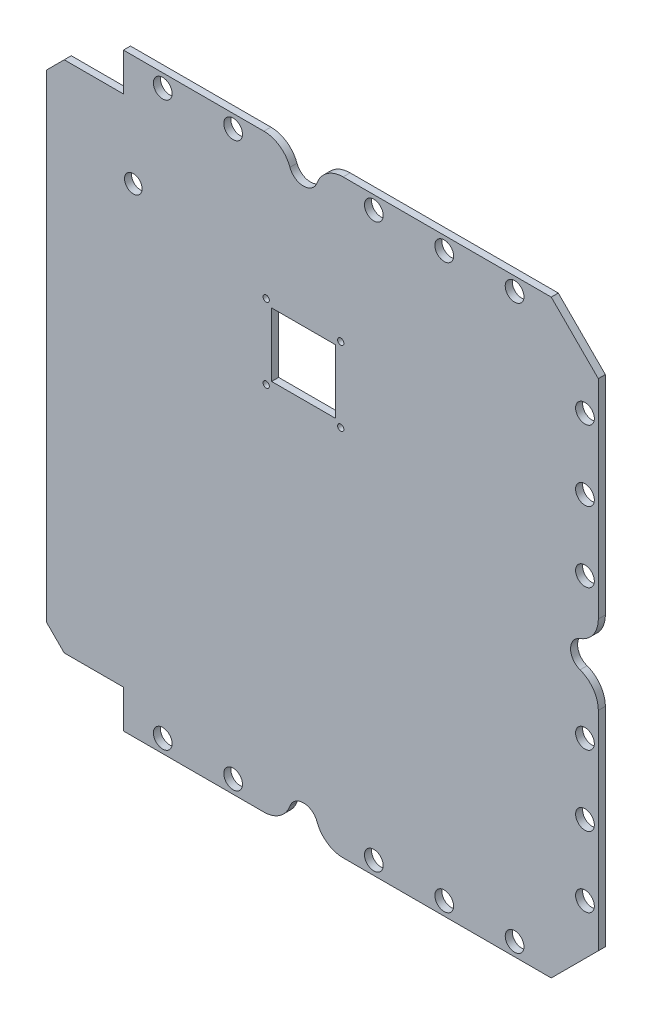
from build123d import *

# Parameters (mm, degrees)
SKETCH1_R             = 3.38
SKETCH1_W             = 23
SKETCH1_H             = 23
SKETCH1_R_2           = 1.13
SKETCH1_R_3           = 3.175
BOSS_EXTRUDE1_DEPTH   = 2.54
F_4_40_TAPPED_HOLE1_D = 2.2606
FILLET1_R             = 10


with BuildPart() as part:
    # Sketch1 → Boss-Extrude1 (new body)
    with BuildSketch(Plane.XY):
        with BuildLine():
            Line((101.231699996, -8e-08), (41.425999995, -8e-08))
            Line((41.425999995, -8e-08), (41.425999995, -13.716000085))
            Line((41.425999995, -13.716000085), (20.065999995, -13.716000085))
            Line((20.065999995, -13.716000085), (13.715999995, -20.066000085))
            Line((13.715999995, -20.066000085), (13.715999995, -192.786000085))
            Line((13.715999995, -192.786000085), (20.065999995, -199.136000085))
            Line((20.065999995, -199.136000085), (41.425999995, -199.136000085))
            Line((41.425999995, -199.136000085), (41.425999995, -212.852000091))
            Line((41.425999995, -212.852000091), (101.231699997, -212.852000091))
            Line((101.231699997, -212.852000091), (101.231699997, -208.02600019))
            ThreePointArc((101.231699996, -208.02600019), (106.425999995, -202.83170019), (111.620299995, -208.02600019))
            Line((111.620299996, -208.02600019), (111.620299996, -212.852000091))
            Line((111.620299996, -212.852000091), (195.854149957, -212.852000091))
            Line((195.854149957, -212.852000091), (212.851999956, -195.854150092))
            Line((212.851999956, -195.854150092), (212.851999956, -111.620300137))
            Line((212.851999956, -111.620300137), (208.026000047, -111.620300137))
            ThreePointArc((208.026000047, -111.620300137), (202.831700048, -106.426000137), (208.026000047, -101.231700138))
            Line((208.026000047, -101.231700138), (212.851999956, -101.231700138))
            Line((212.851999956, -101.231700138), (212.851999956, -16.997850079))
            Line((212.851999956, -16.997850079), (195.854149957, -8e-08))
            Line((195.854149957, -8e-08), (111.620299995, -8e-08))
            Line((111.620299995, -8e-08), (111.620299995, -4.826000085))
            ThreePointArc((111.620299994, -4.826000085), (106.425999995, -10.020300084), (101.231699996, -4.826000085))
            Line((101.231699996, -4.826000085), (101.231699996, -8e-08))
        make_face()
        with Locations((55.625999995, -208.02600019)):
            Circle(SKETCH1_R, mode=Mode.SUBTRACT)
        with Locations((81.025999995, -208.02600019)):
            Circle(SKETCH1_R, mode=Mode.SUBTRACT)
        with Locations((131.825999995, -208.02600019)):
            Circle(SKETCH1_R, mode=Mode.SUBTRACT)
        with Locations((157.225999995, -208.02600019)):
            Circle(SKETCH1_R, mode=Mode.SUBTRACT)
        with Locations((182.625999995, -208.02600019)):
            Circle(SKETCH1_R, mode=Mode.SUBTRACT)
        with Locations((208.026000047, -182.626000137)):
            Circle(SKETCH1_R, mode=Mode.SUBTRACT)
        with Locations((208.026000047, -157.226000137)):
            Circle(SKETCH1_R, mode=Mode.SUBTRACT)
        with Locations((208.026000047, -131.826000137)):
            Circle(SKETCH1_R, mode=Mode.SUBTRACT)
        with Locations((55.625999995, -4.826000085)):
            Circle(SKETCH1_R, mode=Mode.SUBTRACT)
        with Locations((81.025999995, -4.826000085)):
            Circle(SKETCH1_R, mode=Mode.SUBTRACT)
        with Locations((208.026000047, -81.026000137)):
            Circle(SKETCH1_R, mode=Mode.SUBTRACT)
        with Locations((208.026000047, -55.626000137)):
            Circle(SKETCH1_R, mode=Mode.SUBTRACT)
        with Locations((131.825999995, -4.826000085)):
            Circle(SKETCH1_R, mode=Mode.SUBTRACT)
        with Locations((157.225999995, -4.826000085)):
            Circle(SKETCH1_R, mode=Mode.SUBTRACT)
        with Locations((208.026000047, -30.226000137)):
            Circle(SKETCH1_R, mode=Mode.SUBTRACT)
        with Locations((182.625999995, -4.826000085)):
            Circle(SKETCH1_R, mode=Mode.SUBTRACT)
        with Locations((106.426000003, -65.34289)):
            Rectangle(SKETCH1_W, SKETCH1_H, mode=Mode.SUBTRACT)
        with Locations((119.876000003, -51.89289)):
            Circle(SKETCH1_R_2, mode=Mode.SUBTRACT)
        with Locations((92.976000003, -78.79289)):
            Circle(SKETCH1_R_2, mode=Mode.SUBTRACT)
        with Locations((45, -40)):
            Circle(SKETCH1_R_3, mode=Mode.SUBTRACT)
        with Locations((92.976000003, -51.89289)):
            Circle(SKETCH1_R_2, mode=Mode.SUBTRACT)
        with Locations((119.876000003, -78.79289)):
            Circle(SKETCH1_R_2, mode=Mode.SUBTRACT)
    extrude(amount=BOSS_EXTRUDE1_DEPTH)

    # #4-40 Tapped Hole1 (through all)
    with Locations(Plane(origin=(92.976000003, -51.89289, 2.54), x_dir=(1, 0, 0), z_dir=(0, 0, 1))):
        with Locations((0, 0), (26.9, 0), (26.9, -26.9), (0, -26.9)):
            Hole(F_4_40_TAPPED_HOLE1_D / 2)

    # Fillet1
    fillet1_edges = [part.edges().sort_by_distance(p)[0] for p in [
        (101.231699997, -212.852000091, 1.27),
        (111.620299996, -212.852000091, 1.27),
        (212.851999956, -111.620300137, 1.27),
        (212.851999956, -101.231700138, 1.27),
        (111.620299995, -8e-08, 1.27),
        (101.231699996, -8e-08, 1.27),
    ]]
    fillet(fillet1_edges, radius=FILLET1_R)


solid = part.part
